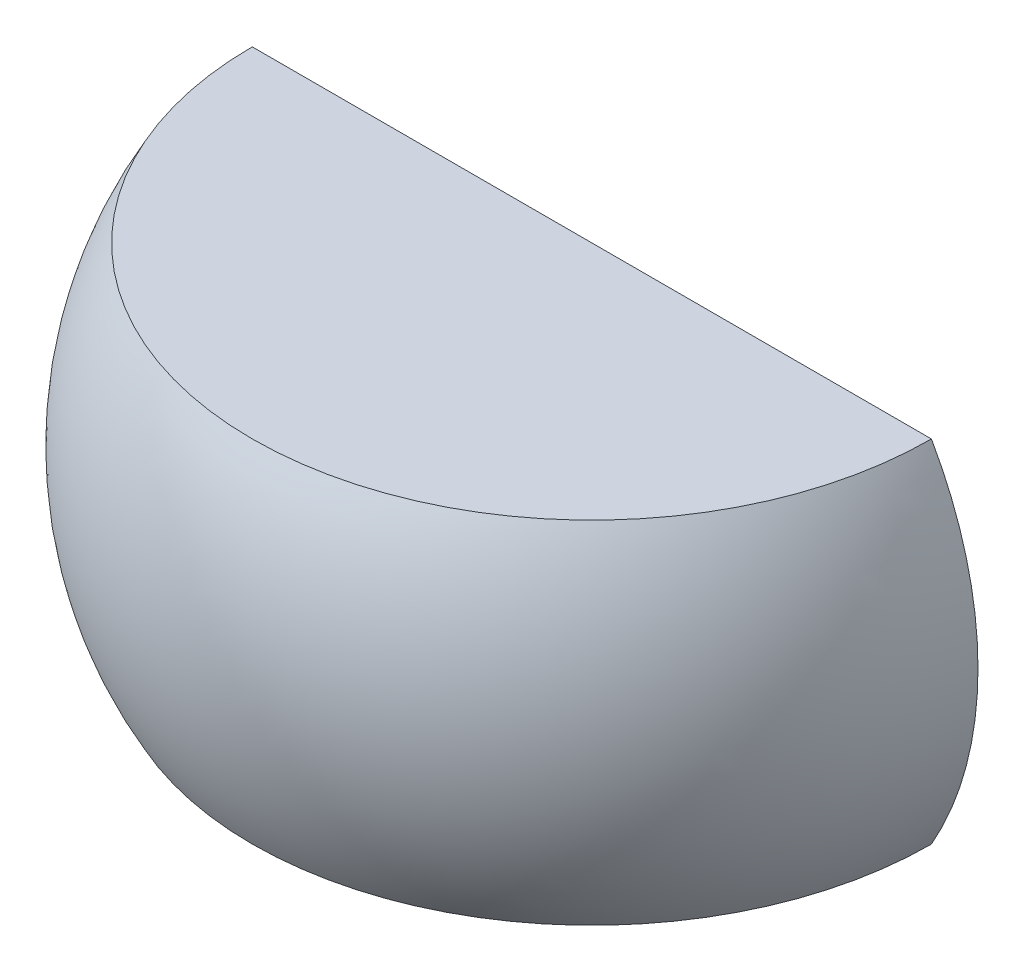
from build123d import *

# Parameters (mm, degrees)
REVOLUCI_N1_ANGLE     = 180
CROQUIS2_W            = 2
CROQUIS2_H            = 3
CORTAR_EXTRUIR1_DEPTH = 15
CORTAR_EXTRUIR2_START = -6.6
CROQUIS3_W            = 7.076217781
CROQUIS3_H            = 3
CROQUIS3_W_2          = 6.688868885
CORTAR_EXTRUIR2_DEPTH = 6.6


with BuildPart() as part:
    # Croquis1 → Revolución1 (revolve)
    with BuildSketch(Plane.XY):
        with BuildLine():
            Line((-51.782166939, -4.382597623), (-31.582166939, -4.382597623))
            Line((-31.582166939, -4.382597623), (-31.582166939, -19.966657293))
            Line((-31.582166939, -19.966657293), (-36.798543174, -13.956174379))
            Line((-36.798543174, -13.956174379), (-36.798543174, -5.882597623))
            Line((-36.798543174, -5.882597623), (-43.248543174, -5.882597623))
            Line((-43.248543174, -5.882597623), (-53.282166939, -5.882597623))
            ThreePointArc((-53.282166939, -5.882597623), (-56.573748762, 6.516780598), (-53.282166939, 18.916158819))
            Line((-53.282166939, 18.916158819), (-29.282166939, 18.916158819))
            Line((-29.282166939, 18.916158819), (-29.282166939, 17.416158819))
            Line((-29.282166939, 17.416158819), (-51.782166939, 17.416158819))
            ThreePointArc((-51.782166939, 17.416158819), (-54.283199087, 6.516780598), (-51.782166939, -4.382597623))
        make_face()
    revolve(axis=Axis((-29.282166939, 17.416158819, 0), (0, 1, 0)), revolution_arc=REVOLUCI_N1_ANGLE)

    # Croquis2 → Cortar-Extruir1 (cut)
    with BuildSketch(Plane(origin=(0, 0, 0), x_dir=(-1, 0, 0), z_dir=(0, 0, -1))):
        with Locations((24.982166939, -7.382597623)):
            Rectangle(CROQUIS2_W, CROQUIS2_H)
        with Locations((33.582166939, -7.382597623)):
            Rectangle(CROQUIS2_W, CROQUIS2_H)
        with Locations((33.582166939, -11.382597623)):
            Rectangle(CROQUIS2_W, CROQUIS2_H)
        with Locations((24.982166939, -11.382597623)):
            Rectangle(CROQUIS2_W, CROQUIS2_H)
    extrude(amount=-CORTAR_EXTRUIR1_DEPTH, mode=Mode.SUBTRACT)

    # Croquis3 → Cortar-Extruir2 (cut)
    with BuildSketch(Plane.ZY.offset(32.582166939).offset(CORTAR_EXTRUIR2_START)):
        with Locations((8.321249271, -11.382597623)):
            Rectangle(CROQUIS3_W, CROQUIS3_H)
        with Locations((8.127574822, -7.382597623)):
            Rectangle(CROQUIS3_W_2, CROQUIS3_H)
    extrude(amount=CORTAR_EXTRUIR2_DEPTH, mode=Mode.SUBTRACT)


solid = part.part
